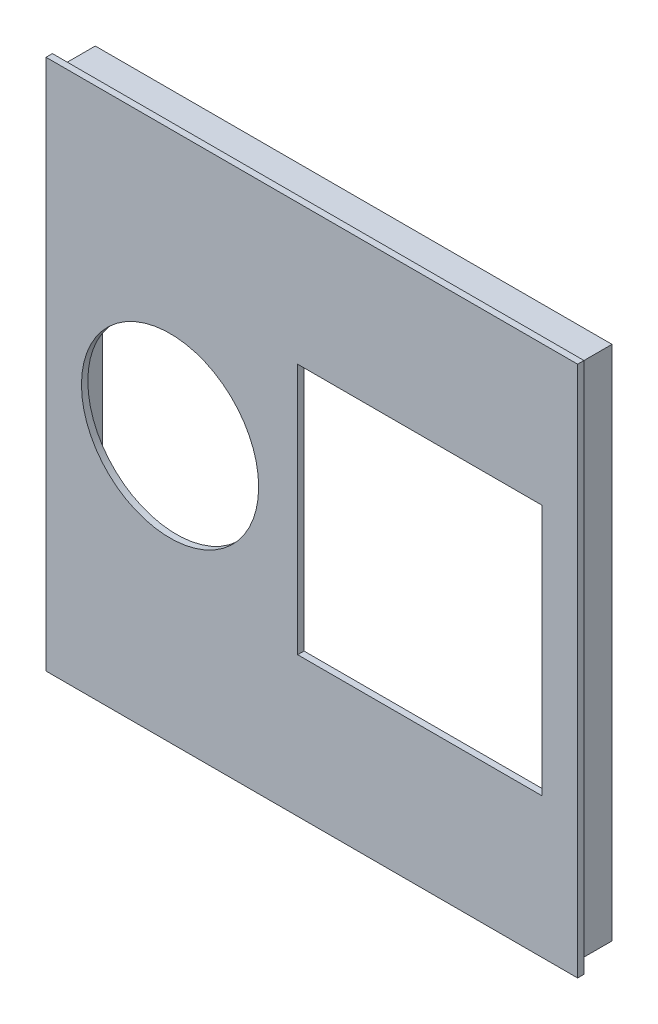
from build123d import *

# Parameters (mm, degrees)
CROQUIS1_W              = 150
CROQUIS1_H              = 150
CROQUIS1_R              = 25
CROQUIS1_W_2            = 69
CROQUIS1_H_2            = 71
SALIENTE_EXTRUIR1_DEPTH = 1.8
CROQUIS2_W              = 145.8
CROQUIS2_H              = 145.8
CROQUIS2_W_2            = 141.6
CROQUIS2_H_2            = 141.6
SALIENTE_EXTRUIR2_DEPTH = 10


with BuildPart() as part:
    # Croquis1 → Saliente-Extruir1 (new body)
    with BuildSketch(Plane.XY):
        with Locations((57.57534771, -67.552941176)):
            Rectangle(CROQUIS1_W, CROQUIS1_H)
        with Locations((17.57534771, -67.552941176)):
            Circle(CROQUIS1_R, mode=Mode.SUBTRACT)
        with Locations((88.07534771, -67.552941176)):
            Rectangle(CROQUIS1_W_2, CROQUIS1_H_2, mode=Mode.SUBTRACT)
    extrude(amount=SALIENTE_EXTRUIR1_DEPTH)

    # Croquis2 → Saliente-Extruir2 (add)
    with BuildSketch(Plane(origin=(0, 0, 0), x_dir=(-1, 0, 0), z_dir=(0, 0, -1))):
        with Locations((-57.57534771, -67.552941176)):
            Rectangle(CROQUIS2_W, CROQUIS2_H)
        with Locations((-57.57534771, -67.552941176)):
            Rectangle(CROQUIS2_W_2, CROQUIS2_H_2, mode=Mode.SUBTRACT)
    extrude(amount=SALIENTE_EXTRUIR2_DEPTH)


solid = part.part
